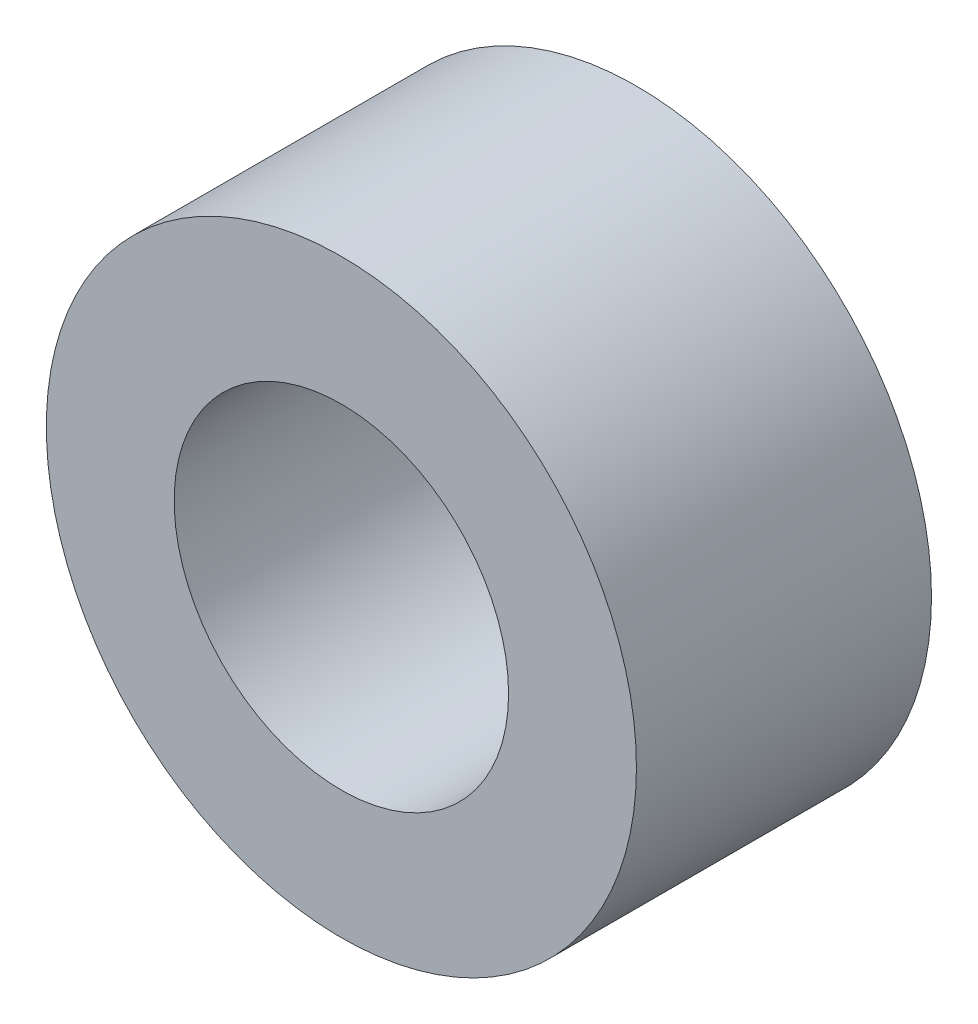
from build123d import *

# Parameters (mm, degrees)
MAIN_PROFILE_SKETCH_R   = 3
MAIN_PROFILE_SKETCH_R_2 = 1.7
MAIN_EXTRUSION_DEPTH    = 3


with BuildPart() as part:
    # Main Profile Sketch → Main Extrusion (new body)
    with BuildSketch(Plane.XY.offset(51.5)):
        with Locations((-151.5, -27)):
            Circle(MAIN_PROFILE_SKETCH_R)
        with Locations((-151.5, -27)):
            Circle(MAIN_PROFILE_SKETCH_R_2, mode=Mode.SUBTRACT)
    extrude(amount=-MAIN_EXTRUSION_DEPTH)


solid = part.part
